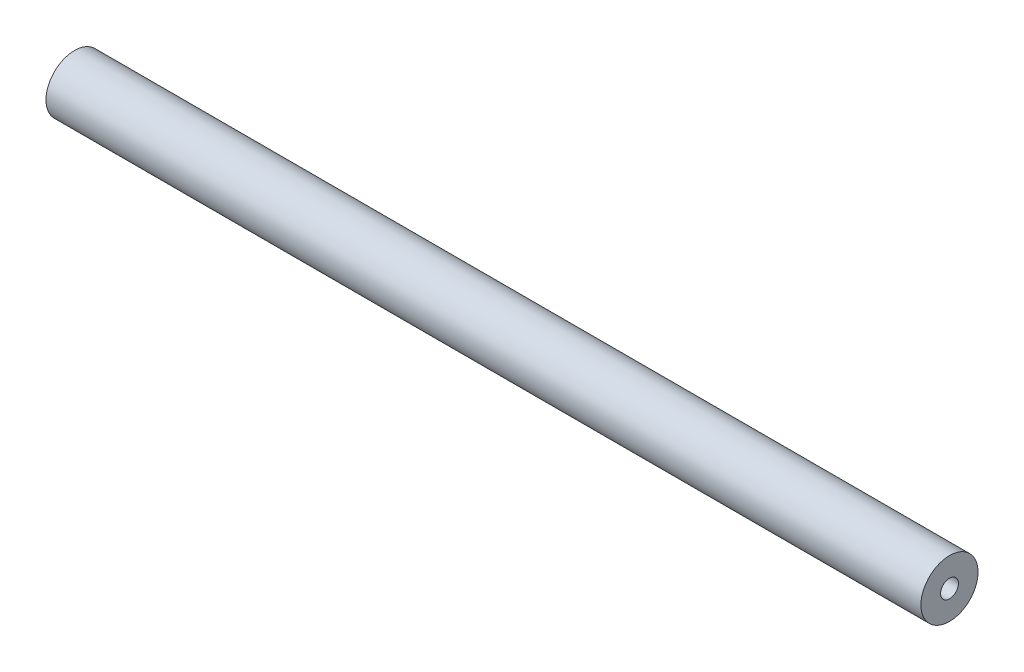
from build123d import *

# Parameters (mm, degrees)
SKETCH_2_R      = 4
EXTRUDE_1_DEPTH = 61.25


with BuildPart() as part:
    # 스케치2 → 보스-돌출1 (new body)
    with BuildSketch(Plane(origin=(0, 0, 0), x_dir=(0, 0, -1), z_dir=(1, 0, 0))):
        Circle(SKETCH_2_R)
    extrude_1 = extrude(amount=EXTRUDE_1_DEPTH)

    # 스케치4 → M3x0.5 나사 구멍1 (revolve, cut)
    with BuildSketch(Plane(origin=(61.25, 0, 0), x_dir=(0, 0, -1), z_dir=(0, 1, 0))):
        Polygon((0, 0), (0, 22.251075774), (1.25, 21.5), (1.25, 0), align=None)
    m3x0_5_1 = revolve(axis=Axis((67.6, 0, 0), (-1, 0, 0)), mode=Mode.SUBTRACT)

    # 대칭 복사1: 보스-돌출1, M3x0.5 나사 구멍1 across plane
    add(extrude_1.mirror(Plane(origin=(0, 0, 0), x_dir=(0, 0, 1), z_dir=(1, 0, 0))))
    add(m3x0_5_1.mirror(Plane(origin=(0, 0, 0), x_dir=(0, 0, 1), z_dir=(1, 0, 0))), mode=Mode.SUBTRACT)


solid = part.part
